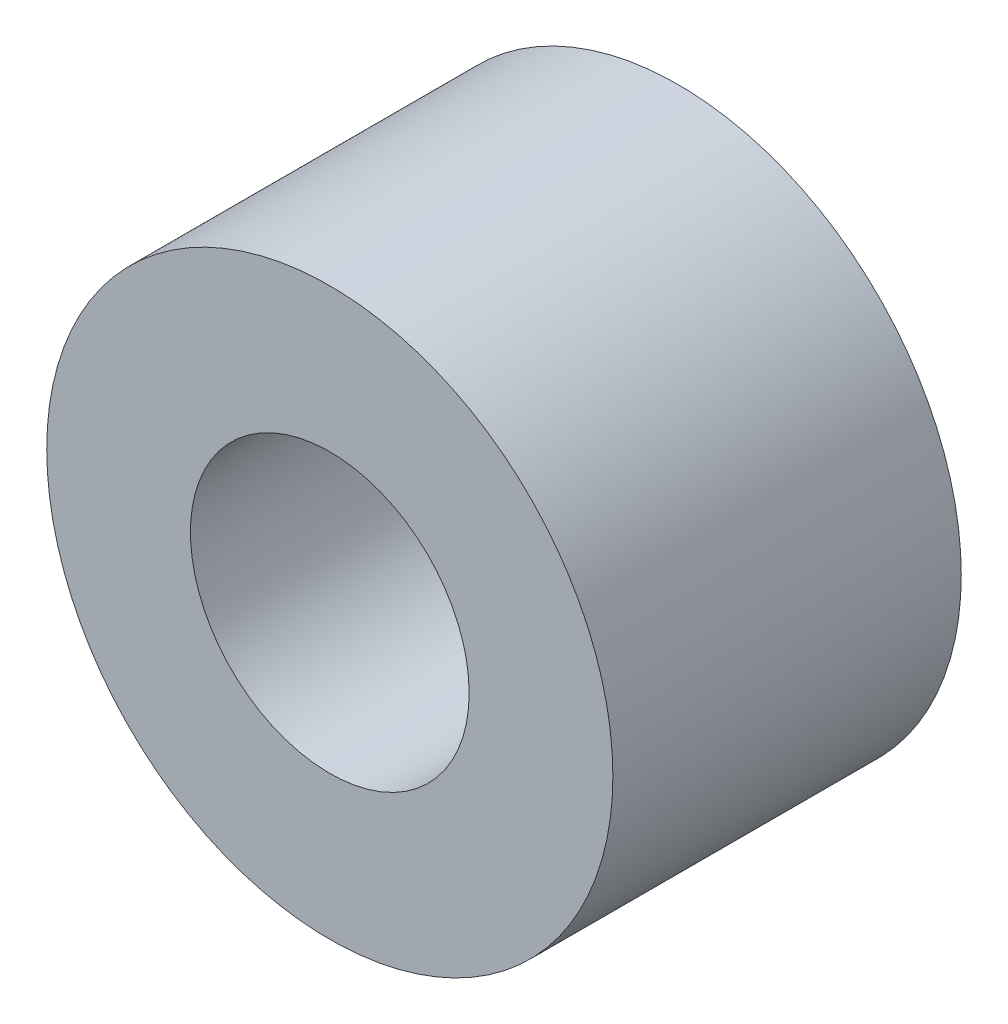
from build123d import *

# Parameters (mm, degrees)
SKETCH1_R           = 3.25
SKETCH1_R_2         = 1.6
BOSS_EXTRUDE1_DEPTH = 4


with BuildPart() as part:
    # Sketch1 → Boss-Extrude1 (new body)
    with BuildSketch(Plane.XY):
        Circle(SKETCH1_R)
        Circle(SKETCH1_R_2, mode=Mode.SUBTRACT)
    extrude(amount=BOSS_EXTRUDE1_DEPTH)


solid = part.part
